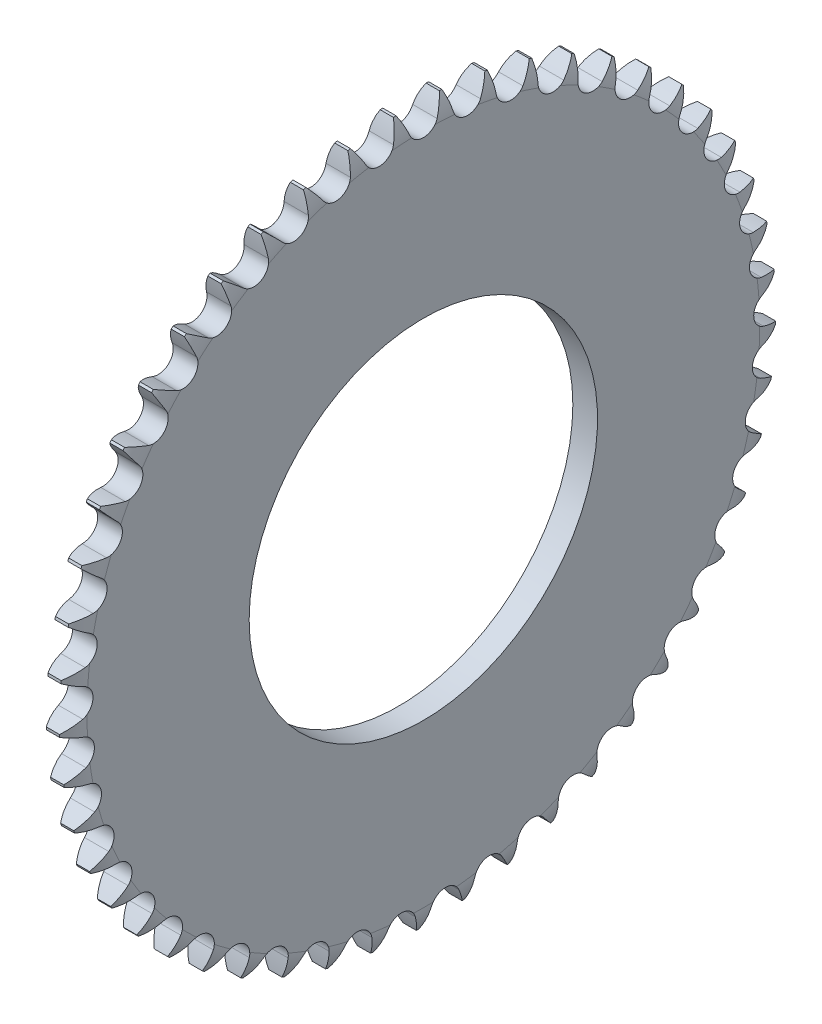
from build123d import *

# Parameters (mm, degrees)
TOOTHCUT_DEPTH  = 110.180570355
TEETHCUTS_COUNT = 49
TEETHCUTS_ANGLE = 352.653061224
BORSKE_R        = 37.5
BORE_DEPTH      = 50.0005


with BuildPart() as part:
    # BasProSke → Base-Revolve (revolve)
    with BuildSketch(Plane(origin=(0, 0, 0), x_dir=(1, 0, 0), z_dir=(0, 1, 0)), mode=Mode.PRIVATE) as base_revolve_sk:
        with BuildLine():
            Line((0, 0), (0, 72.414754422))
            ThreePointArc((0, 72.414754422), (0.314698702, 74.842917308), (1.238, 77.110630911))
            Line((1.238, 77.110630911), (4.0816, 77.110630911))
            ThreePointArc((4.0816, 77.110630911), (5.004901298, 74.842917308), (5.3196, 72.414754422))
            Line((5.3196, 72.414754422), (5.3196, 0))
            Line((5.3196, 0), (0, 0))
        make_face()
    revolve(base_revolve_sk.sketch.rotate(Axis((-10, 0, 0), (1, 0, 0)), 180), axis=Axis((-10, 0, 0), (1, 0, 0)))

    # TooCutSke → ToothCut (cut, through all)
    with BuildSketch(Plane(origin=(0, 0, 0), x_dir=(0, 0, -1), z_dir=(1, 0, 0))):
        with BuildLine():
            ThreePointArc((2.995393321, 73.219326038), (3.890362692, 75.365864825), (4.912128461, 77.455025817))
            ThreePointArc((4.912128461, 77.455025817), (0, 77.610630911), (-4.912128461, 77.455025817))
            ThreePointArc((-4.912128461, 77.455025817), (-3.890362692, 75.365864825), (-2.995393321, 73.219326038))
            ThreePointArc((-2.995393321, 73.219326038), (0, 71.157505911), (2.995393321, 73.219326038))
        make_face()
    toothcut = extrude(amount=TOOTHCUT_DEPTH, mode=Mode.SUBTRACT)

    # TeethCuts: ToothCut ×49 about axis
    teethcuts_axis = Axis((-10, 0, 0), (1, 0, 0))
    for i in range(1, TEETHCUTS_COUNT):
        add(toothcut.rotate(teethcuts_axis, i * TEETHCUTS_ANGLE / (TEETHCUTS_COUNT - 1)), mode=Mode.SUBTRACT)

    # BorSke → Bore (cut, symmetric)
    with BuildSketch(Plane(origin=(0, 0, 0), x_dir=(0, 0, -1), z_dir=(1, 0, 0))):
        with Locations(Location((0, 0, 0), (0, 0, 180))):
            Circle(BORSKE_R)
    extrude(amount=BORE_DEPTH, both=True, mode=Mode.SUBTRACT)


solid = part.part
